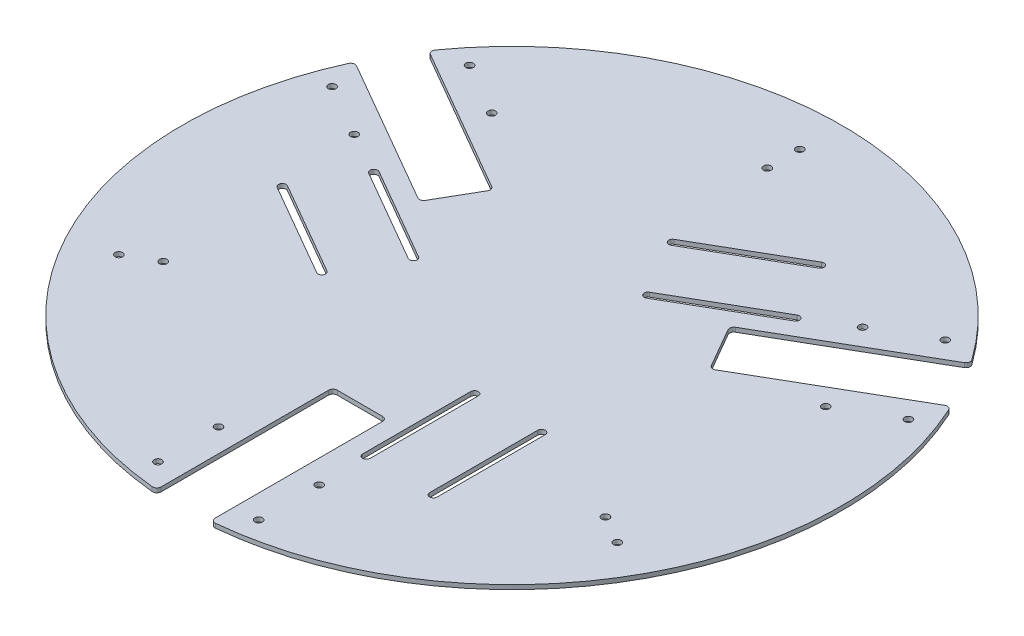
from build123d import *

# Parameters (mm, degrees)
SKETCH1_R           = 1.75
BOSS_EXTRUDE1_DEPTH = 2


with BuildPart() as part:
    # Sketch1 → Boss-Extrude1 (new body)
    with BuildSketch(Plane(origin=(0, 0, 0), x_dir=(1, 0, 0), z_dir=(0, 1, 0))):
        with BuildLine():
            Line((-12.5, -149.799866489), (-12.5, -72.328332691))
            ThreePointArc((-12.5, -72.328332691), (-11.914213562, -70.914119129), (-10.5, -70.328332691))
            Line((-10.5, -70.328332691), (10.5, -70.328332691))
            ThreePointArc((10.5, -70.328332691), (11.914213562, -70.914119129), (12.5, -72.328332691))
            Line((12.5, -72.328332691), (12.5, -149.799866489))
            ThreePointArc((12.5, -149.799866489), (13.155638081, -151.280640283), (14.69269103, -151.790562389))
            ThreePointArc((14.69269103, -151.790562389), (132.068874077, -76.25), (138.800828598, 63.171037513))
            ThreePointArc((138.800828598, 63.171037513), (137.590696626, 64.247203361), (135.980489863, 64.074615697))
            Line((135.980489863, 64.074615697), (68.888173524, 25.338848798))
            ThreePointArc((68.888173524, 25.338848798), (67.370535433, 25.139047953), (66.156122716, 26.070899606))
            Line((66.156122716, 26.070899606), (55.656122716, 44.257433085))
            ThreePointArc((55.656122716, 44.257433085), (55.456321871, 45.775071175), (56.388173524, 46.989483893))
            Line((56.388173524, 46.989483893), (123.480489863, 85.725250792))
            ThreePointArc((123.480489863, 85.725250792), (124.435058545, 87.033436922), (124.108137568, 88.619524876))
            ThreePointArc((124.108137568, 88.619524876), (0, 152.5), (-124.108137568, 88.619524876))
            ThreePointArc((-124.108137568, 88.619524876), (-124.435058545, 87.033436922), (-123.480489863, 85.725250792))
            Line((-123.480489863, 85.725250792), (-56.388173524, 46.989483893))
            ThreePointArc((-56.388173524, 46.989483893), (-55.456321871, 45.775071175), (-55.656122716, 44.257433085))
            Line((-55.656122716, 44.257433085), (-66.156122716, 26.070899606))
            ThreePointArc((-66.156122716, 26.070899606), (-67.370535433, 25.139047953), (-68.888173524, 25.338848798))
            Line((-68.888173524, 25.338848798), (-135.980489863, 64.074615697))
            ThreePointArc((-135.980489863, 64.074615697), (-137.590696626, 64.247203361), (-138.800828598, 63.171037513))
            ThreePointArc((-138.800828598, 63.171037513), (-132.068874077, -76.25), (-14.69269103, -151.790562389))
            ThreePointArc((-14.69269103, -151.790562389), (-13.155638081, -151.280640283), (-12.5, -149.799866489))
        make_face()
        with Locations(Location((115.282765815, -66.558535876, 0), (0, 0, 270))):
            Circle(SKETCH1_R, mode=Mode.SUBTRACT)
        with Locations(Location((102.292384759, -59.058535876, 0), (0, 0, 270))):
            Circle(SKETCH1_R, mode=Mode.SUBTRACT)
        with Locations(Location((-115.282765815, -66.558535876, 0), (0, 0, 270))):
            Circle(SKETCH1_R, mode=Mode.SUBTRACT)
        with Locations(Location((-102.292384759, -59.058535876, 0), (0, 0, 270))):
            Circle(SKETCH1_R, mode=Mode.SUBTRACT)
        with Locations(Location((0, 133.117071753, 0), (0, 0, 270))):
            Circle(SKETCH1_R, mode=Mode.SUBTRACT)
        with Locations(Location((0, 118.117071753, 0), (0, 0, 270))):
            Circle(SKETCH1_R, mode=Mode.SUBTRACT)
        with Locations(Location((110.01987893, 90.400875942, 0), (0, 0, 270))):
            Circle(SKETCH1_R, mode=Mode.SUBTRACT)
        with Locations(Location((85.771167624, 76.400875942, 0), (0, 0, 270))):
            Circle(SKETCH1_R, mode=Mode.SUBTRACT)
        with Locations(Location((133.29987893, 50.078733142, 0), (0, 0, 270))):
            Circle(SKETCH1_R, mode=Mode.SUBTRACT)
        with Locations(Location((109.051167624, 36.078733142, 0), (0, 0, 270))):
            Circle(SKETCH1_R, mode=Mode.SUBTRACT)
        with Locations(Location((23.280000001, -140.480448046, 0), (0, 0, 270))):
            Circle(SKETCH1_R, mode=Mode.SUBTRACT)
        with Locations(Location((23.280000001, -112.480448046, 0), (0, 0, 270))):
            Circle(SKETCH1_R, mode=Mode.SUBTRACT)
        with Locations(Location((-23.279999999, -140.480448046, 0), (0, 0, 270))):
            Circle(SKETCH1_R, mode=Mode.SUBTRACT)
        with Locations(Location((-23.279999999, -112.480448046, 0), (0, 0, 270))):
            Circle(SKETCH1_R, mode=Mode.SUBTRACT)
        with Locations(Location((-133.299152367, 50.079152622, 0), (0, 0, 270))):
            Circle(SKETCH1_R, mode=Mode.SUBTRACT)
        with Locations(Location((-109.050441061, 36.079152622, 0), (0, 0, 270))):
            Circle(SKETCH1_R, mode=Mode.SUBTRACT)
        with Locations(Location((-110.019152367, 90.401295422, 0), (0, 0, 270))):
            Circle(SKETCH1_R, mode=Mode.SUBTRACT)
        with Locations(Location((-85.770441061, 76.401295422, 0), (0, 0, 270))):
            Circle(SKETCH1_R, mode=Mode.SUBTRACT)
        with BuildLine():
            Line((20.91, -89.999866489), (20.91, -39.999866489))
            ThreePointArc((20.91, -39.999866489), (22.66, -38.249866489), (24.41, -39.999866489))
            Line((24.41, -39.999866489), (24.41, -89.999866489))
            ThreePointArc((24.41, -89.999866489), (22.66, -91.749866489), (20.91, -89.999866489))
        make_face(mode=Mode.SUBTRACT)
        with BuildLine():
            Line((55.410000001, -89.999866489), (55.410000001, -39.999866489))
            ThreePointArc((55.410000001, -39.999866489), (53.660000001, -38.249866489), (51.910000001, -39.999866489))
            Line((51.910000001, -39.999866489), (51.910000001, -89.999866489))
            ThreePointArc((51.910000001, -89.999866489), (53.660000001, -91.749866489), (55.410000001, -89.999866489))
        make_face(mode=Mode.SUBTRACT)
        with BuildLine():
            Line((-105.647170717, -2.98653438), (-62.345900528, -27.98653438))
            ThreePointArc((-62.345900528, -27.98653438), (-59.955356071, -27.345989924), (-60.595900528, -24.955445467))
            Line((-60.595900528, -24.955445467), (-103.897170717, 0.044554533))
            ThreePointArc((-103.897170717, 0.044554533), (-106.287715174, -0.595989924), (-105.647170717, -2.98653438))
        make_face(mode=Mode.SUBTRACT)
        with BuildLine():
            Line((-90.147170716, 23.860253138), (-46.845900527, -1.139746862))
            ThreePointArc((-46.845900527, -1.139746862), (-44.45535607, -0.499202405), (-45.095900527, 1.891342051))
            Line((-45.095900527, 1.891342051), (-88.397170716, 26.891342051))
            ThreePointArc((-88.397170716, 26.891342051), (-90.787715173, 26.250797595), (-90.147170716, 23.860253138))
        make_face(mode=Mode.SUBTRACT)
        with BuildLine():
            Line((50.237170716, 92.986400869), (6.935900526, 67.986400869))
            ThreePointArc((6.935900526, 67.986400869), (6.29535607, 65.595856412), (8.685900526, 64.955311956))
            Line((8.685900526, 64.955311956), (51.987170716, 89.955311956))
            ThreePointArc((51.987170716, 89.955311956), (52.627715172, 92.345856412), (50.237170716, 92.986400869))
        make_face(mode=Mode.SUBTRACT)
        with BuildLine():
            Line((65.737170716, 66.139613351), (22.435900527, 41.139613351))
            ThreePointArc((22.435900527, 41.139613351), (21.79535607, 38.749068894), (24.185900527, 38.108524437))
            Line((24.185900527, 38.108524437), (67.487170716, 63.108524437))
            ThreePointArc((67.487170716, 63.108524437), (68.127715173, 65.499068894), (65.737170716, 66.139613351))
        make_face(mode=Mode.SUBTRACT)
    extrude(amount=BOSS_EXTRUDE1_DEPTH)


solid = part.part
